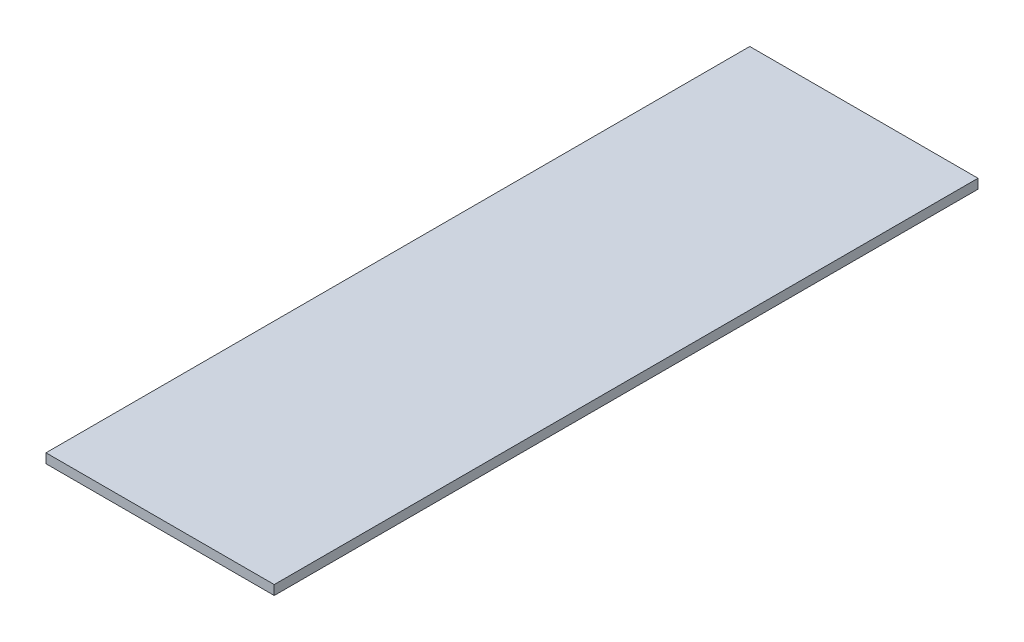
from build123d import *

# Parameters (mm, degrees)
SKETCH1_W           = 120
SKETCH1_H           = 370
BOSS_EXTRUDE1_DEPTH = 5


with BuildPart() as part:
    # Sketch1 → Boss-Extrude1 (new body)
    with BuildSketch(Plane(origin=(0, 0, 0), x_dir=(1, 0, 0), z_dir=(0, 1, 0))):
        with Locations((60, 185)):
            Rectangle(SKETCH1_W, SKETCH1_H)
    extrude(amount=BOSS_EXTRUDE1_DEPTH)


solid = part.part
